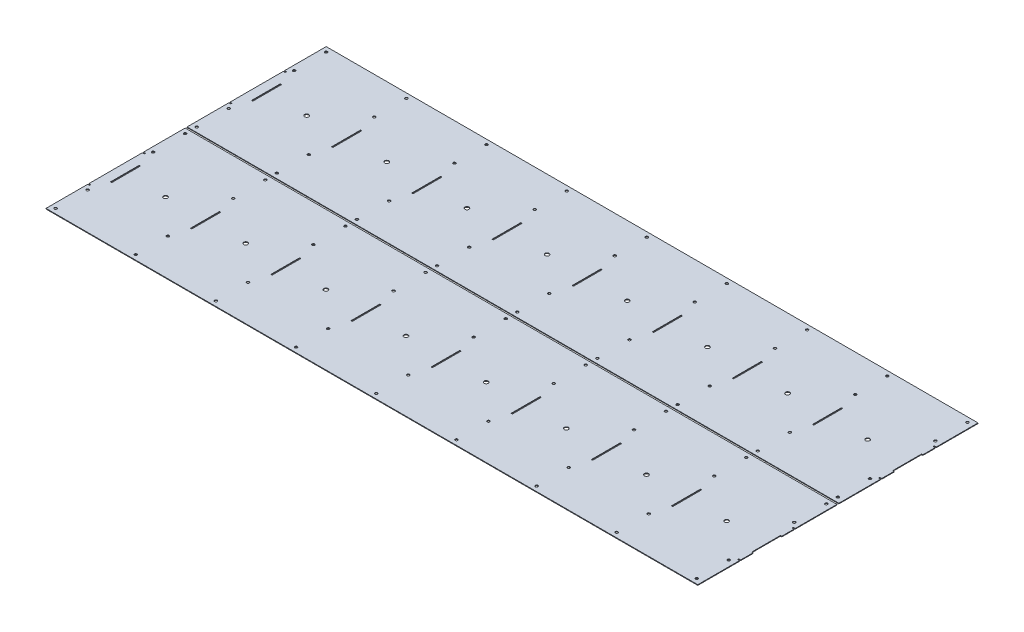
from build123d import *

# Parameters (mm, degrees)
SKETCH1_R           = 2
SKETCH1_R_2         = 3.175
SKETCH1_W           = 2
SKETCH1_H           = 45
BOSS_EXTRUDE1_DEPTH = 1
LPATTERN1_COUNT     = 2
LPATTERN1_PITCH     = 220


with BuildPart() as part:
    # Sketch1 → Boss-Extrude1 (new body)
    with BuildSketch(Plane(origin=(0, 0, 0), x_dir=(1, 0, 0), z_dir=(0, 1, 0))):
        Polygon((-15.5, -108.5), (1001, -108.5), (1001, -43.5), (998, -43.5), (998, -41.5), (1001, -41.5), (1001, -22.5), (999, -22.5), (999, 22.5), (1001, 22.5), (1001, 41.5), (998, 41.5), (998, 43.5), (1001, 43.5), (1001, 108.5), (-15.5, 108.5), (-15.5, 43.5), (-12.5, 43.5), (-12.5, 41.5), (-15.5, 41.5), (-15.5, -41.5), (-12.5, -41.5), (-12.5, -43.5), (-15.5, -43.5), align=None)
        with Locations(Location((-8, -101, 0), (0, 0, 270))):
            Circle(SKETCH1_R, mode=Mode.SUBTRACT)
        with Locations(Location((-8, -51, 0), (0, 0, 270))):
            Circle(SKETCH1_R, mode=Mode.SUBTRACT)
        with Locations(Location((-8, 51, 0), (0, 0, 90))):
            Circle(SKETCH1_R, mode=Mode.SUBTRACT)
        with Locations(Location((-8, 101, 0), (0, 0, 90))):
            Circle(SKETCH1_R, mode=Mode.SUBTRACT)
        with Locations(Location((117, -101, 0), (0, 0, 270))):
            Circle(SKETCH1_R, mode=Mode.SUBTRACT)
        with Locations(Location((117, -51, 0), (0, 0, 270))):
            Circle(SKETCH1_R, mode=Mode.SUBTRACT)
        with Locations(Location((117, 51, 0), (0, 0, 90))):
            Circle(SKETCH1_R, mode=Mode.SUBTRACT)
        with Locations(Location((117, 101, 0), (0, 0, 90))):
            Circle(SKETCH1_R, mode=Mode.SUBTRACT)
        with Locations(Location((242, -101, 0), (0, 0, 270))):
            Circle(SKETCH1_R, mode=Mode.SUBTRACT)
        with Locations(Location((242, -51, 0), (0, 0, 270))):
            Circle(SKETCH1_R, mode=Mode.SUBTRACT)
        with Locations(Location((242, 51, 0), (0, 0, 90))):
            Circle(SKETCH1_R, mode=Mode.SUBTRACT)
        with Locations(Location((242, 101, 0), (0, 0, 90))):
            Circle(SKETCH1_R, mode=Mode.SUBTRACT)
        with Locations(Location((367, -101, 0), (0, 0, 270))):
            Circle(SKETCH1_R, mode=Mode.SUBTRACT)
        with Locations(Location((367, -51, 0), (0, 0, 270))):
            Circle(SKETCH1_R, mode=Mode.SUBTRACT)
        with Locations(Location((367, 51, 0), (0, 0, 90))):
            Circle(SKETCH1_R, mode=Mode.SUBTRACT)
        with Locations(Location((367, 101, 0), (0, 0, 90))):
            Circle(SKETCH1_R, mode=Mode.SUBTRACT)
        with Locations(Location((62.5, 0, 0), (0, 0, 270))):
            Circle(SKETCH1_R_2, mode=Mode.SUBTRACT)
        with Locations(Location((187.5, 0, 0), (0, 0, 270))):
            Circle(SKETCH1_R_2, mode=Mode.SUBTRACT)
        with Locations(Location((312.5, 0, 0), (0, 0, 270))):
            Circle(SKETCH1_R_2, mode=Mode.SUBTRACT)
        with Locations(Location((437.5, 0, 0), (0, 0, 270))):
            Circle(SKETCH1_R_2, mode=Mode.SUBTRACT)
        with Locations(Location((492, -101, 0), (0, 0, 270))):
            Circle(SKETCH1_R, mode=Mode.SUBTRACT)
        with Locations(Location((492, -51, 0), (0, 0, 270))):
            Circle(SKETCH1_R, mode=Mode.SUBTRACT)
        with Locations(Location((492, 51, 0), (0, 0, 90))):
            Circle(SKETCH1_R, mode=Mode.SUBTRACT)
        with Locations(Location((492, 101, 0), (0, 0, 90))):
            Circle(SKETCH1_R, mode=Mode.SUBTRACT)
        with Locations(Location((562.5, 0, 0), (0, 0, 270))):
            Circle(SKETCH1_R_2, mode=Mode.SUBTRACT)
        with Locations(Location((617, -101, 0), (0, 0, 270))):
            Circle(SKETCH1_R, mode=Mode.SUBTRACT)
        with Locations(Location((617, -51, 0), (0, 0, 270))):
            Circle(SKETCH1_R, mode=Mode.SUBTRACT)
        with Locations(Location((617, 51, 0), (0, 0, 90))):
            Circle(SKETCH1_R, mode=Mode.SUBTRACT)
        with Locations(Location((617, 101, 0), (0, 0, 90))):
            Circle(SKETCH1_R, mode=Mode.SUBTRACT)
        with Locations(Location((687.5, 0, 0), (0, 0, 270))):
            Circle(SKETCH1_R_2, mode=Mode.SUBTRACT)
        with Locations(Location((742, -101, 0), (0, 0, 270))):
            Circle(SKETCH1_R, mode=Mode.SUBTRACT)
        with Locations(Location((742, -51, 0), (0, 0, 270))):
            Circle(SKETCH1_R, mode=Mode.SUBTRACT)
        with Locations(Location((742, 51, 0), (0, 0, 90))):
            Circle(SKETCH1_R, mode=Mode.SUBTRACT)
        with Locations(Location((742, 101, 0), (0, 0, 90))):
            Circle(SKETCH1_R, mode=Mode.SUBTRACT)
        with Locations(Location((812.5, 0, 0), (0, 0, 270))):
            Circle(SKETCH1_R_2, mode=Mode.SUBTRACT)
        with Locations(Location((867, -101, 0), (0, 0, 270))):
            Circle(SKETCH1_R, mode=Mode.SUBTRACT)
        with Locations(Location((867, -51, 0), (0, 0, 270))):
            Circle(SKETCH1_R, mode=Mode.SUBTRACT)
        with Locations(Location((867, 51, 0), (0, 0, 90))):
            Circle(SKETCH1_R, mode=Mode.SUBTRACT)
        with Locations(Location((867, 101, 0), (0, 0, 90))):
            Circle(SKETCH1_R, mode=Mode.SUBTRACT)
        with Locations(Location((937.5, 0, 0), (0, 0, 270))):
            Circle(SKETCH1_R_2, mode=Mode.SUBTRACT)
        with Locations(Location((992, -101, 0), (0, 0, 270))):
            Circle(SKETCH1_R, mode=Mode.SUBTRACT)
        with Locations(Location((992, -51, 0), (0, 0, 270))):
            Circle(SKETCH1_R, mode=Mode.SUBTRACT)
        with Locations(Location((992, 51, 0), (0, 0, 90))):
            Circle(SKETCH1_R, mode=Mode.SUBTRACT)
        with Locations(Location((992, 101, 0), (0, 0, 90))):
            Circle(SKETCH1_R, mode=Mode.SUBTRACT)
        with Locations((125, 0)):
            Rectangle(SKETCH1_W, SKETCH1_H, mode=Mode.SUBTRACT)
        Rectangle(SKETCH1_W, SKETCH1_H, mode=Mode.SUBTRACT)
        with Locations((250, 0)):
            Rectangle(SKETCH1_W, SKETCH1_H, mode=Mode.SUBTRACT)
        with Locations((375, 0)):
            Rectangle(SKETCH1_W, SKETCH1_H, mode=Mode.SUBTRACT)
        with Locations((500, 0)):
            Rectangle(SKETCH1_W, SKETCH1_H, mode=Mode.SUBTRACT)
        with Locations((625, 0)):
            Rectangle(SKETCH1_W, SKETCH1_H, mode=Mode.SUBTRACT)
        with Locations((750, 0)):
            Rectangle(SKETCH1_W, SKETCH1_H, mode=Mode.SUBTRACT)
        with Locations((875, 0)):
            Rectangle(SKETCH1_W, SKETCH1_H, mode=Mode.SUBTRACT)
    extrude(amount=BOSS_EXTRUDE1_DEPTH)


with BuildPart() as lpattern1_1:
    # LPattern1: pattern copy
    add(part.part.moved(Location(Vector(0, 0, -1) * (1 * LPATTERN1_PITCH))))


solid = Compound([part.part, lpattern1_1.part])
